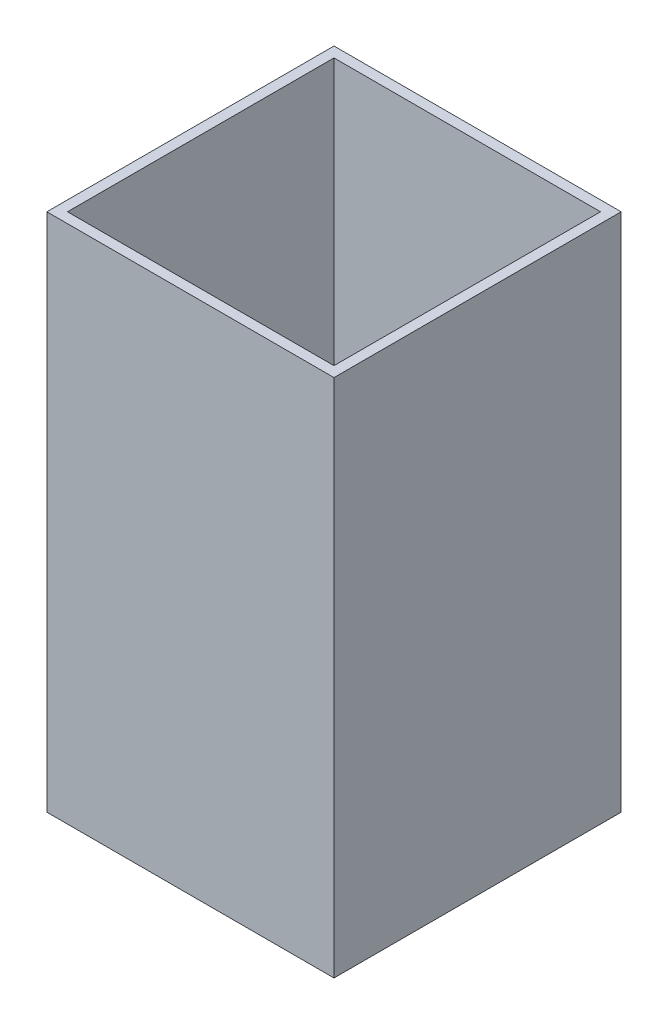
from build123d import *

# Parameters (mm, degrees)
SKETCH1_W           = 88.35
SKETCH1_H           = 88.35
SKETCH1_W_2         = 82
SKETCH1_H_2         = 82
BOSS_EXTRUDE1_DEPTH = 160
SKETCH2_W           = 88.35
SKETCH2_H           = 88.35
BOSS_EXTRUDE2_DEPTH = 3.175


with BuildPart() as part:
    # Sketch1 → Boss-Extrude1 (new body)
    with BuildSketch(Plane(origin=(0, 0, 0), x_dir=(1, 0, 0), z_dir=(0, 1, 0))):
        with Locations((44.175, 44.175)):
            Rectangle(SKETCH1_W, SKETCH1_H)
        with Locations((44.175, 44.175)):
            Rectangle(SKETCH1_W_2, SKETCH1_H_2, mode=Mode.SUBTRACT)
    extrude(amount=BOSS_EXTRUDE1_DEPTH)

    # Sketch2 → Boss-Extrude2 (add)
    with BuildSketch(Plane.XZ):
        with Locations((44.175, -44.175)):
            Rectangle(SKETCH2_W, SKETCH2_H)
    extrude(amount=-BOSS_EXTRUDE2_DEPTH)


solid = part.part
